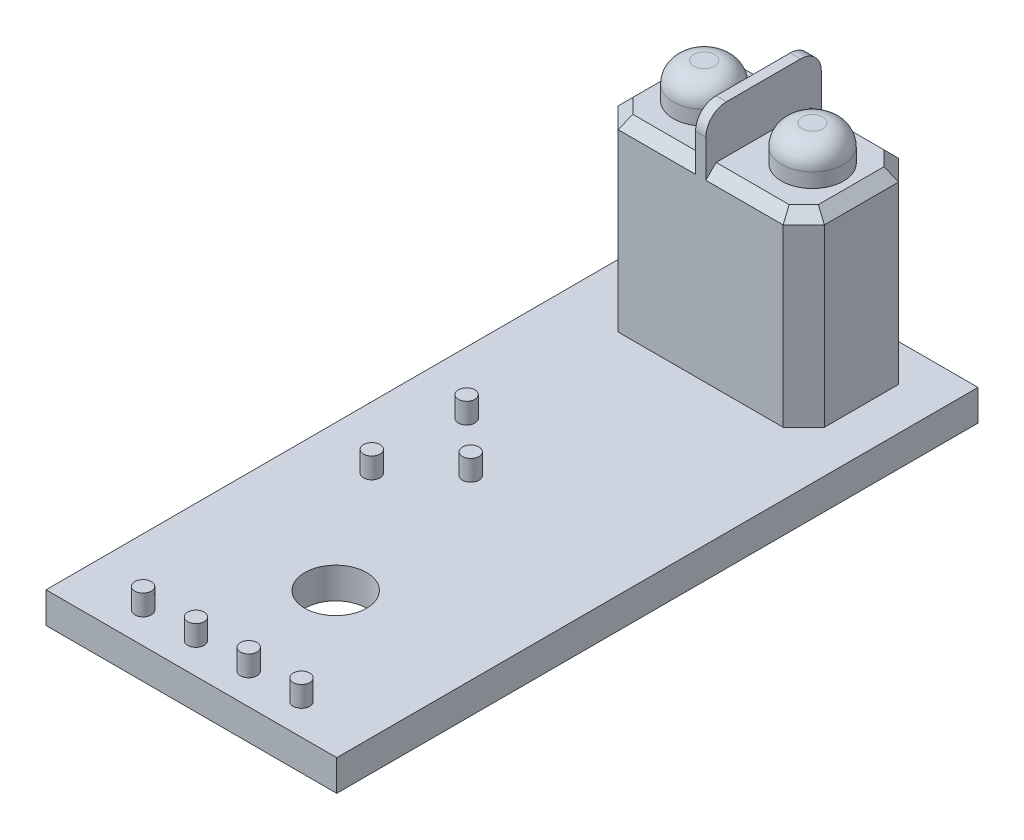
from build123d import *

# Parameters (mm, degrees)
SKETCH1_W           = 14.1
SKETCH1_H           = 31.1
BOSS_EXTRUDE1_DEPTH = 1.5
SKETCH2_W           = 10
SKETCH2_H           = 5.6
BOSS_EXTRUDE2_DEPTH = 9
SKETCH3_W           = 0.5
SKETCH3_H           = 5.6
BOSS_EXTRUDE3_DEPTH = 2.3
SKETCH4_R           = 1.5
BOSS_EXTRUDE4_DEPTH = 1.7
CHAMFER1_SIZE       = 1
CHAMFER2_SIZE       = 0.5
FILLET1_R           = 1
FILLET2_R           = 1
SKETCH5_R           = 0.4
BOSS_EXTRUDE5_DEPTH = 1
SKETCH6_R           = 1.5
CUT_EXTRUDE1_DEPTH  = 11


with BuildPart() as part:
    # Sketch1 → Boss-Extrude1 (new body)
    with BuildSketch(Plane(origin=(0, 0, 0), x_dir=(1, 0, 0), z_dir=(0, 1, 0))):
        Rectangle(SKETCH1_W, SKETCH1_H)
    extrude(amount=BOSS_EXTRUDE1_DEPTH)

    # Sketch2 → Boss-Extrude2 (add)
    with BuildSketch(Plane(origin=(0, 1.5, 0), x_dir=(1, 0, 0), z_dir=(0, 1, 0))):
        with Locations((0, 11.95)):
            Rectangle(SKETCH2_W, SKETCH2_H)
    extrude(amount=BOSS_EXTRUDE2_DEPTH)

    # Sketch3 → Boss-Extrude3 (add)
    with BuildSketch(Plane(origin=(0, 10.5, 0), x_dir=(1, 0, 0), z_dir=(0, 1, 0))):
        with Locations((0, 11.95)):
            Rectangle(SKETCH3_W, SKETCH3_H)
    extrude(amount=BOSS_EXTRUDE3_DEPTH)

    # Sketch4 → Boss-Extrude4 (add)
    with BuildSketch(Plane(origin=(0, 10.5, 0), x_dir=(1, 0, 0), z_dir=(0, 1, 0))):
        with Locations(Location((-2.625, 11.95, 0), (0, 0, 270))):
            Circle(SKETCH4_R)
        with Locations(Location((2.625, 11.95, 0), (0, 0, 270))):
            Circle(SKETCH4_R)
    extrude(amount=BOSS_EXTRUDE4_DEPTH)

    # Chamfer1
    chamfer1_edges = [part.edges().sort_by_distance(p)[0] for p in [
        (5, 6, -9.15),
        (5, 6, -14.75),
        (-5, 6, -14.75),
        (-5, 6, -9.15),
    ]]
    chamfer(chamfer1_edges, length=CHAMFER1_SIZE)

    # Chamfer2
    chamfer2_edges = [part.edges().sort_by_distance(p)[0] for p in [
        (-2.125, 10.5, -14.75),
        (2.125, 10.5, -9.15),
        (-5, 10.5, -11.95),
        (2.125, 10.5, -14.75),
        (-2.125, 10.5, -9.15),
        (-4.5, 10.5, -9.65),
        (-4.5, 10.5, -14.25),
        (5, 10.5, -11.95),
        (4.5, 10.5, -14.25),
        (4.5, 10.5, -9.65),
    ]]
    chamfer(chamfer2_edges, length=CHAMFER2_SIZE)

    # Fillet1
    fillet1_edges = [part.edges().sort_by_distance(p)[0] for p in [
        (-2.625, 12.2, -13.45),
        (2.625, 12.2, -13.45),
    ]]
    fillet(fillet1_edges, radius=FILLET1_R)

    # Fillet2
    fillet2_edges = [part.edges().sort_by_distance(p)[0] for p in [
        (0, 12.8, -14.75),
        (0, 12.8, -9.15),
    ]]
    fillet(fillet2_edges, radius=FILLET2_R)

    # Sketch5 → Boss-Extrude5 (add)
    with BuildSketch(Plane(origin=(0, 1.5, 0), x_dir=(1, 0, 0), z_dir=(0, 1, 0))):
        with Locations(Location((-4.05, 1.85, 0), (0, 0, 270))):
            Circle(SKETCH5_R)
        with Locations(Location((-1.55, -0.45, 0), (0, 0, 270))):
            Circle(SKETCH5_R)
        with Locations(Location((-4.05, -2.75, 0), (0, 0, 270))):
            Circle(SKETCH5_R)
        with Locations(Location((-3.84, -14.05, 0), (0, 0, 270))):
            Circle(SKETCH5_R)
        with Locations(Location((-1.28, -14.05, 0), (0, 0, 270))):
            Circle(SKETCH5_R)
        with Locations(Location((1.28, -14.05, 0), (0, 0, 270))):
            Circle(SKETCH5_R)
        with Locations(Location((3.84, -14.05, 0), (0, 0, 270))):
            Circle(SKETCH5_R)
    extrude(amount=BOSS_EXTRUDE5_DEPTH)

    # Sketch6 → Cut-Extrude1 (cut)
    with BuildSketch(Plane(origin=(0, 1.5, 0), x_dir=(1, 0, 0), z_dir=(0, 1, 0))):
        with Locations(Location((0, -8.55, 0), (0, 0, 270))):
            Circle(SKETCH6_R)
    extrude(amount=-CUT_EXTRUDE1_DEPTH, mode=Mode.SUBTRACT)


solid = part.part
